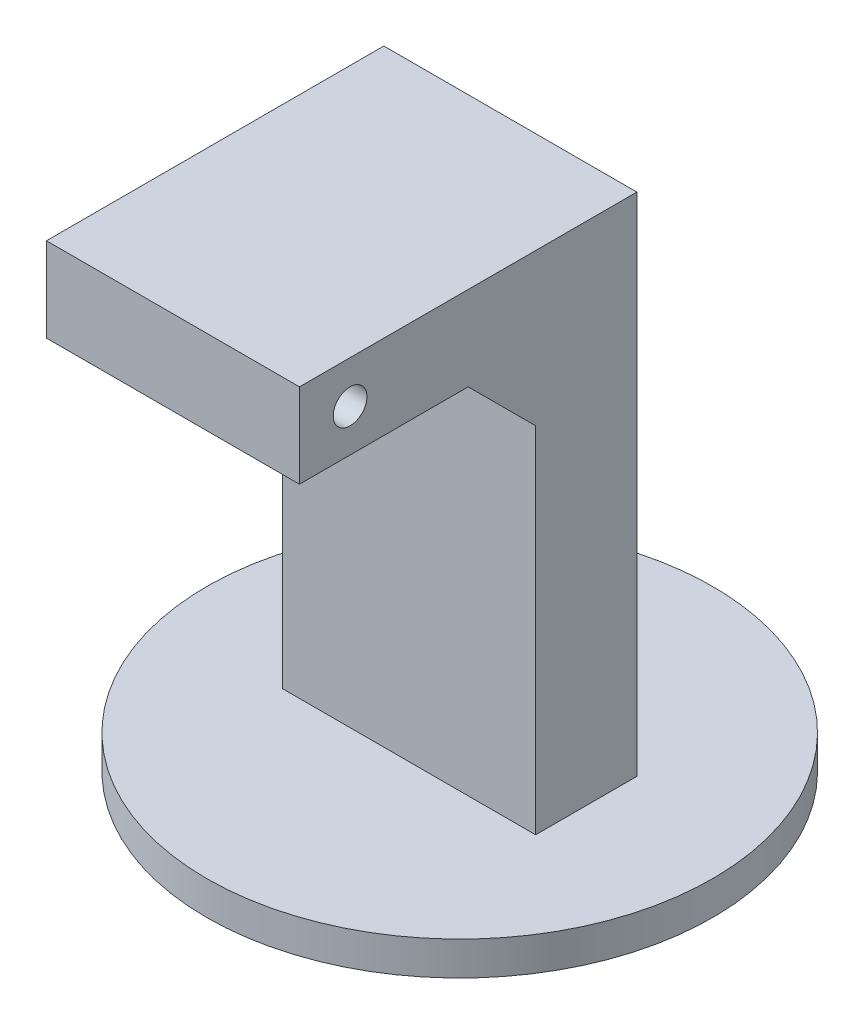
from build123d import *

# Parameters (mm, degrees)
SKETCH1_R           = 15
BOSS_EXTRUDE1_DEPTH = 2
SKETCH2_W           = 15
SKETCH2_H           = 6
BOSS_EXTRUDE2_DEPTH = 25
SKETCH3_W           = 15
SKETCH3_H           = 20
BOSS_EXTRUDE3_DEPTH = 5
CHAMFER1_SIZE       = 4
SKETCH4_R           = 1
CUT_EXTRUDE1_DEPTH  = 15


with BuildPart() as part:
    # Sketch1 → Boss-Extrude1 (new body)
    with BuildSketch(Plane(origin=(0, 0, 0), x_dir=(1, 0, 0), z_dir=(0, 1, 0))):
        with Locations(Location((0, 0, 0), (0, 0, 270))):
            Circle(SKETCH1_R)
    extrude(amount=BOSS_EXTRUDE1_DEPTH)

    # Sketch2 → Boss-Extrude2 (add)
    with BuildSketch(Plane(origin=(0, 2, 0), x_dir=(1, 0, 0), z_dir=(0, 1, 0))):
        Rectangle(SKETCH2_W, SKETCH2_H)
    extrude(amount=BOSS_EXTRUDE2_DEPTH)

    # Sketch3 → Boss-Extrude3 (add)
    with BuildSketch(Plane(origin=(0, 27, 0), x_dir=(1, 0, 0), z_dir=(0, 1, 0))):
        with Locations((0, -7)):
            Rectangle(SKETCH3_W, SKETCH3_H)
    extrude(amount=BOSS_EXTRUDE3_DEPTH)

    # Chamfer1
    chamfer1_edges = [part.edges().sort_by_distance(p)[0] for p in [
        (0, 27, 3),
    ]]
    chamfer(chamfer1_edges, length=CHAMFER1_SIZE)

    # Sketch4 → Cut-Extrude1 (cut)
    with BuildSketch(Plane(origin=(7.5, 0, 0), x_dir=(0, 0, -1), z_dir=(1, 0, 0))):
        with Locations((-14, 29.5)):
            Circle(SKETCH4_R)
    extrude(amount=-CUT_EXTRUDE1_DEPTH, mode=Mode.SUBTRACT)


solid = part.part
